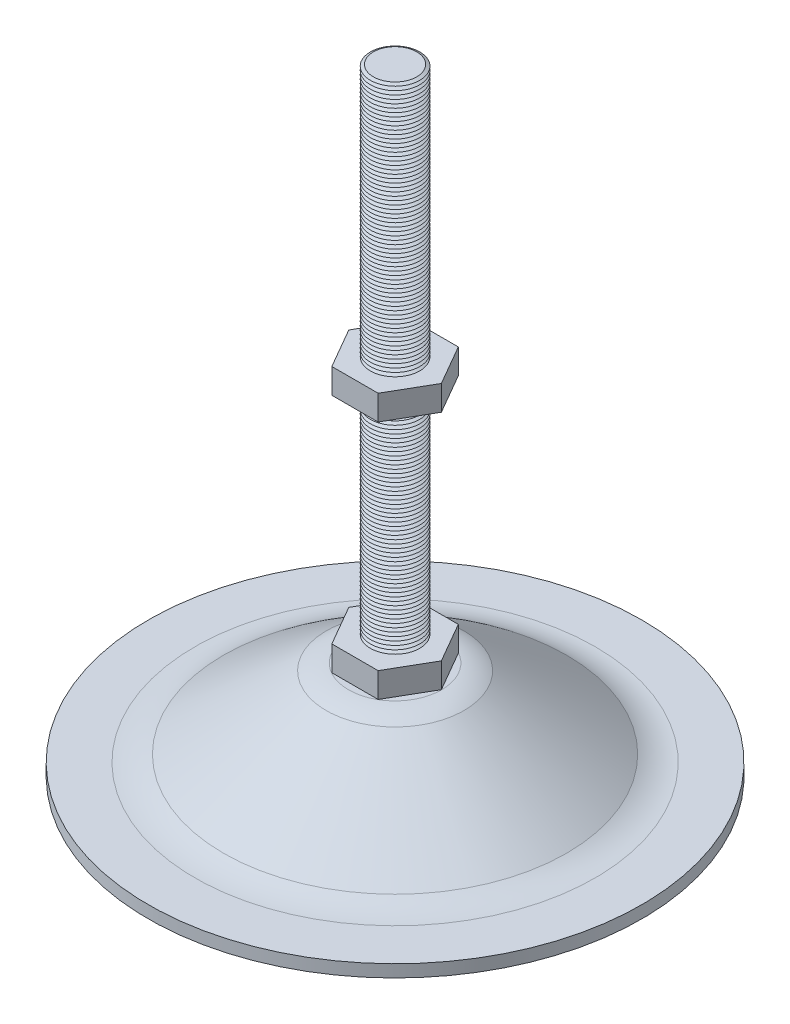
from build123d import *

# Parameters (mm, degrees)
SKETCH_3_W          = 34.813298254
SKETCH_3_H          = 36.284540707
CUT_EXTRUDE_1_DEPTH = 43


with BuildPart() as part:
    # 草图1 → 旋转1 (revolve)
    with BuildSketch(Plane.XY, mode=Mode.PRIVATE) as revolve_1_sk:
        with BuildLine():
            Line((40, -12), (40, -14))
            Line((40, -14), (32.460490166, -14))
            ThreePointArc((32.460490166, -14), (29.593413351, -13.652461995), (26.89240623, -12.629978423))
            Line((26.89240623, -12.629978423), (10.251565792, -0.913347718))
            ThreePointArc((10.251565792, -0.913347718), (8.450894377, -0.231692003), (6.539509834, 0))
            Line((6.539509834, 0), (0, 0))
            Line((0, 0), (0, 86))
            Line((0, 86), (3.512767881, 86))
            Line((3.512767881, 86), (4, 85.748990506))
            Line((4, 85.748990506), (3.4, 85.439885892))
            Line((3.4, 85.439885892), (4, 85.130781278))
            Line((4, 85.130781278), (3.4, 84.821676663))
            Line((3.4, 84.821676663), (4, 84.512572049))
            Line((4, 84.512572049), (3.4, 84.203467434))
            Line((3.4, 84.203467434), (4, 83.89436282))
            Line((4, 83.89436282), (3.4, 83.585258206))
            Line((3.4, 83.585258206), (4, 83.276153591))
            Line((4, 83.276153591), (3.4, 82.967048977))
            Line((3.4, 82.967048977), (4, 82.657944363))
            Line((4, 82.657944363), (3.4, 82.348839748))
            Line((3.4, 82.348839748), (4, 82.039735134))
            Line((4, 82.039735134), (3.4, 81.73063052))
            Line((3.4, 81.73063052), (4, 81.421525905))
            Line((4, 81.421525905), (3.4, 81.112421291))
            Line((3.4, 81.112421291), (4, 80.803316676))
            Line((4, 80.803316676), (3.4, 80.494212062))
            Line((3.4, 80.494212062), (4, 80.185107448))
            Line((4, 80.185107448), (3.4, 79.876002833))
            Line((3.4, 79.876002833), (4, 79.566898219))
            Line((4, 79.566898219), (3.4, 79.257793605))
            Line((3.4, 79.257793605), (4, 78.94868899))
            Line((4, 78.94868899), (3.4, 78.639584376))
            Line((3.4, 78.639584376), (4, 78.330479762))
            Line((4, 78.330479762), (3.4, 78.021375147))
            Line((3.4, 78.021375147), (4, 77.712270533))
            Line((4, 77.712270533), (3.4, 77.403165918))
            Line((3.4, 77.403165918), (4, 77.094061304))
            Line((4, 77.094061304), (3.4, 76.78495669))
            Line((3.4, 76.78495669), (4, 76.475852075))
            Line((4, 76.475852075), (3.4, 76.166747461))
            Line((3.4, 76.166747461), (4, 75.857642847))
            Line((4, 75.857642847), (3.4, 75.548538232))
            Line((3.4, 75.548538232), (4, 75.239433618))
            Line((4, 75.239433618), (3.4, 74.930329003))
            Line((3.4, 74.930329003), (4, 74.621224389))
            Line((4, 74.621224389), (3.4, 74.312119775))
            Line((3.4, 74.312119775), (4, 74.00301516))
            Line((4, 74.00301516), (3.4, 73.693910546))
            Line((3.4, 73.693910546), (4, 73.384805932))
            Line((4, 73.384805932), (3.4, 73.075701317))
            Line((3.4, 73.075701317), (4, 72.766596703))
            Line((4, 72.766596703), (3.4, 72.457492089))
            Line((3.4, 72.457492089), (4, 72.148387474))
            Line((4, 72.148387474), (3.4, 71.83928286))
            Line((3.4, 71.83928286), (4, 71.530178245))
            Line((4, 71.530178245), (3.4, 71.221073631))
            Line((3.4, 71.221073631), (4, 70.911969017))
            Line((4, 70.911969017), (3.4, 70.602864402))
            Line((3.4, 70.602864402), (4, 70.293759788))
            Line((4, 70.293759788), (3.4, 69.984655174))
            Line((3.4, 69.984655174), (4, 69.675550559))
            Line((4, 69.675550559), (3.4, 69.366445945))
            Line((3.4, 69.366445945), (4, 69.057341331))
            Line((4, 69.057341331), (3.4, 68.748236716))
            Line((3.4, 68.748236716), (4, 68.439132102))
            Line((4, 68.439132102), (3.4, 68.130027487))
            Line((3.4, 68.130027487), (4, 67.820922873))
            Line((4, 67.820922873), (3.4, 67.511818259))
            Line((3.4, 67.511818259), (4, 67.202713644))
            Line((4, 67.202713644), (3.4, 66.89360903))
            Line((3.4, 66.89360903), (4, 66.584504416))
            Line((4, 66.584504416), (3.4, 66.275399801))
            Line((3.4, 66.275399801), (4, 65.966295187))
            Line((4, 65.966295187), (3.4, 65.657190573))
            Line((3.4, 65.657190573), (4, 65.348085958))
            Line((4, 65.348085958), (3.4, 65.038981344))
            Line((3.4, 65.038981344), (4, 64.729876729))
            Line((4, 64.729876729), (3.4, 64.420772115))
            Line((3.4, 64.420772115), (4, 64.111667501))
            Line((4, 64.111667501), (3.4, 63.802562886))
            Line((3.4, 63.802562886), (4, 63.493458272))
            Line((4, 63.493458272), (3.4, 63.184353658))
            Line((3.4, 63.184353658), (4, 62.875249043))
            Line((4, 62.875249043), (3.4, 62.566144429))
            Line((3.4, 62.566144429), (4, 62.257039815))
            Line((4, 62.257039815), (3.4, 61.9479352))
            Line((3.4, 61.9479352), (4, 61.638830586))
            Line((4, 61.638830586), (3.4, 61.329725971))
            Line((3.4, 61.329725971), (4, 61.020621357))
            Line((4, 61.020621357), (3.4, 60.711516743))
            Line((3.4, 60.711516743), (4, 60.402412128))
            Line((4, 60.402412128), (3.4, 60.093307514))
            Line((3.4, 60.093307514), (4, 59.7842029))
            Line((4, 59.7842029), (3.4, 59.475098285))
            Line((3.4, 59.475098285), (4, 59.165993671))
            Line((4, 59.165993671), (3.4, 58.856889056))
            Line((3.4, 58.856889056), (4, 58.547784442))
            Line((4, 58.547784442), (3.4, 58.238679828))
            Line((3.4, 58.238679828), (4, 57.929575213))
            Line((4, 57.929575213), (3.4, 57.620470599))
            Line((3.4, 57.620470599), (4, 57.311365985))
            Line((4, 57.311365985), (3.4, 57.00226137))
            Line((3.4, 57.00226137), (4, 56.693156756))
            Line((4, 56.693156756), (3.4, 56.384052142))
            Line((3.4, 56.384052142), (4, 56.074947527))
            Line((4, 56.074947527), (3.4, 55.765842913))
            Line((3.4, 55.765842913), (4, 55.456738298))
            Line((4, 55.456738298), (3.4, 55.147633684))
            Line((3.4, 55.147633684), (4, 54.83852907))
            Line((4, 54.83852907), (3.4, 54.529424455))
            Line((3.4, 54.529424455), (4, 54.220319841))
            Line((4, 54.220319841), (3.4, 53.911215227))
            Line((3.4, 53.911215227), (4, 53.602110612))
            Line((4, 53.602110612), (3.4, 53.293005998))
            Line((3.4, 53.293005998), (4, 52.983901384))
            Line((4, 52.983901384), (3.4, 52.674796769))
            Line((3.4, 52.674796769), (4, 52.365692155))
            Line((4, 52.365692155), (3.4, 52.05658754))
            Line((3.4, 52.05658754), (4, 51.747482926))
            Line((4, 51.747482926), (3.4, 51.438378312))
            Line((3.4, 51.438378312), (4, 51.129273697))
            Line((4, 51.129273697), (3.4, 50.820169083))
            Line((3.4, 50.820169083), (4, 50.511064469))
            Line((4, 50.511064469), (3.4, 50.201959854))
            Line((3.4, 50.201959854), (4, 49.89285524))
            Line((4, 49.89285524), (3.4, 49.583750626))
            Line((3.4, 49.583750626), (4, 49.274646011))
            Line((4, 49.274646011), (3.4, 48.965541397))
            Line((3.4, 48.965541397), (4, 48.656436782))
            Line((4, 48.656436782), (3.4, 48.347332168))
            Line((3.4, 48.347332168), (4, 48.038227554))
            Line((4, 48.038227554), (3.4, 47.729122939))
            Line((3.4, 47.729122939), (4, 47.420018325))
            Line((4, 47.420018325), (3.4, 47.110913711))
            Line((3.4, 47.110913711), (4, 46.801809096))
            Line((4, 46.801809096), (3.4, 46.492704482))
            Line((3.4, 46.492704482), (4, 46.183599868))
            Line((4, 46.183599868), (3.4, 45.874495253))
            Line((3.4, 45.874495253), (4, 45.565390639))
            Line((4, 45.565390639), (3.4, 45.256286024))
            Line((3.4, 45.256286024), (3.995594301, 44.949451113))
            Line((3.995594301, 44.949451113), (7.5, 44.949451113))
            Line((7.5, 44.949451113), (7.5, 40.903217166))
            Line((7.5, 40.903217166), (3.449700178, 40.903217166))
            Line((3.449700178, 40.903217166), (4, 40.619716809))
            Line((4, 40.619716809), (3.4, 40.310612195))
            Line((3.4, 40.310612195), (4, 40.00150758))
            Line((4, 40.00150758), (3.4, 39.692402966))
            Line((3.4, 39.692402966), (4, 39.383298351))
            Line((4, 39.383298351), (3.4, 39.074193737))
            Line((3.4, 39.074193737), (4, 38.765089123))
            Line((4, 38.765089123), (3.4, 38.455984508))
            Line((3.4, 38.455984508), (4, 38.146879894))
            Line((4, 38.146879894), (3.4, 37.83777528))
            Line((3.4, 37.83777528), (4, 37.528670665))
            Line((4, 37.528670665), (3.4, 37.219566051))
            Line((3.4, 37.219566051), (4, 36.910461437))
            Line((4, 36.910461437), (3.4, 36.601356822))
            Line((3.4, 36.601356822), (4, 36.292252208))
            Line((4, 36.292252208), (3.4, 35.983147593))
            Line((3.4, 35.983147593), (4, 35.674042979))
            Line((4, 35.674042979), (3.4, 35.364938365))
            Line((3.4, 35.364938365), (4, 35.05583375))
            Line((4, 35.05583375), (3.4, 34.746729136))
            Line((3.4, 34.746729136), (4, 34.437624522))
            Line((4, 34.437624522), (3.4, 34.128519907))
            Line((3.4, 34.128519907), (4, 33.819415293))
            Line((4, 33.819415293), (3.4, 33.510310679))
            Line((3.4, 33.510310679), (4, 33.201206064))
            Line((4, 33.201206064), (3.4, 32.89210145))
            Line((3.4, 32.89210145), (4, 32.582996835))
            Line((4, 32.582996835), (3.4, 32.273892221))
            Line((3.4, 32.273892221), (4, 31.964787607))
            Line((4, 31.964787607), (3.4, 31.655682992))
            Line((3.4, 31.655682992), (4, 31.346578378))
            Line((4, 31.346578378), (3.4, 31.037473764))
            Line((3.4, 31.037473764), (4, 30.728369149))
            Line((4, 30.728369149), (3.4, 30.419264535))
            Line((3.4, 30.419264535), (4, 30.110159921))
            Line((4, 30.110159921), (3.4, 29.801055306))
            Line((3.4, 29.801055306), (4, 29.491950692))
            Line((4, 29.491950692), (3.4, 29.182846077))
            Line((3.4, 29.182846077), (4, 28.873741463))
            Line((4, 28.873741463), (3.4, 28.564636849))
            Line((3.4, 28.564636849), (4, 28.255532234))
            Line((4, 28.255532234), (3.4, 27.94642762))
            Line((3.4, 27.94642762), (4, 27.637323006))
            Line((4, 27.637323006), (3.4, 27.328218391))
            Line((3.4, 27.328218391), (4, 27.019113777))
            Line((4, 27.019113777), (3.4, 26.710009162))
            Line((3.4, 26.710009162), (4, 26.400904548))
            Line((4, 26.400904548), (3.4, 26.091799934))
            Line((3.4, 26.091799934), (4, 25.782695319))
            Line((4, 25.782695319), (3.4, 25.473590705))
            Line((3.4, 25.473590705), (4, 25.164486091))
            Line((4, 25.164486091), (3.4, 24.855381476))
            Line((3.4, 24.855381476), (4, 24.546276862))
            Line((4, 24.546276862), (3.4, 24.237172248))
            Line((3.4, 24.237172248), (4, 23.928067633))
            Line((4, 23.928067633), (3.4, 23.618963019))
            Line((3.4, 23.618963019), (4, 23.309858404))
            Line((4, 23.309858404), (3.4, 23.00075379))
            Line((3.4, 23.00075379), (4, 22.691649176))
            Line((4, 22.691649176), (3.4, 22.382544561))
            Line((3.4, 22.382544561), (4, 22.073439947))
            Line((4, 22.073439947), (3.4, 21.764335333))
            Line((3.4, 21.764335333), (4, 21.455230718))
            Line((4, 21.455230718), (3.4, 21.146126104))
            Line((3.4, 21.146126104), (4, 20.83702149))
            Line((4, 20.83702149), (3.4, 20.527916875))
            Line((3.4, 20.527916875), (4, 20.218812261))
            Line((4, 20.218812261), (3.4, 19.909707646))
            Line((3.4, 19.909707646), (4, 19.600603032))
            Line((4, 19.600603032), (3.4, 19.291498418))
            Line((3.4, 19.291498418), (4, 18.982393803))
            Line((4, 18.982393803), (3.4, 18.673289189))
            Line((3.4, 18.673289189), (4, 18.364184575))
            Line((4, 18.364184575), (3.4, 18.05507996))
            Line((3.4, 18.05507996), (4, 17.745975346))
            Line((4, 17.745975346), (3.4, 17.436870732))
            Line((3.4, 17.436870732), (4, 17.127766117))
            Line((4, 17.127766117), (3.4, 16.818661503))
            Line((3.4, 16.818661503), (4, 16.509556888))
            Line((4, 16.509556888), (3.4, 16.200452274))
            Line((3.4, 16.200452274), (4, 15.89134766))
            Line((4, 15.89134766), (3.4, 15.582243045))
            Line((3.4, 15.582243045), (4, 15.273138431))
            Line((4, 15.273138431), (3.4, 14.964033817))
            Line((3.4, 14.964033817), (4, 14.654929202))
            Line((4, 14.654929202), (3.4, 14.345824588))
            Line((3.4, 14.345824588), (4, 14.036719974))
            Line((4, 14.036719974), (3.4, 13.727615359))
            Line((3.4, 13.727615359), (4, 13.418510745))
            Line((4, 13.418510745), (3.4, 13.10940613))
            Line((3.4, 13.10940613), (4, 12.800301516))
            Line((4, 12.800301516), (3.4, 12.491196902))
            Line((3.4, 12.491196902), (4, 12.182092287))
            Line((4, 12.182092287), (3.4, 11.872987673))
            Line((3.4, 11.872987673), (4, 11.563883059))
            Line((4, 11.563883059), (3.4, 11.254778444))
            Line((3.4, 11.254778444), (4, 10.94567383))
            Line((4, 10.94567383), (3.4, 10.636569215))
            Line((3.4, 10.636569215), (4, 10.327464601))
            Line((4, 10.327464601), (3.4, 10.018359987))
            Line((3.4, 10.018359987), (4, 9.709255372))
            Line((4, 9.709255372), (3.4, 9.400150758))
            Line((3.4, 9.400150758), (4, 9.091046144))
            Line((4, 9.091046144), (3.4, 8.781941529))
            Line((3.4, 8.781941529), (4, 8.472836915))
            Line((4, 8.472836915), (3.4, 8.163732301))
            Line((3.4, 8.163732301), (4, 7.854627686))
            Line((4, 7.854627686), (3.4, 7.545523072))
            Line((3.4, 7.545523072), (4, 7.236418457))
            Line((4, 7.236418457), (3.4, 6.927313843))
            Line((3.4, 6.927313843), (4, 6.618209229))
            Line((4, 6.618209229), (3.4, 6.309104614))
            Line((3.4, 6.309104614), (4, 6))
            Line((4, 6), (7.5, 6))
            Line((7.5, 6), (7.5, 1.953766053))
            ThreePointArc((7.5, 1.953766053), (9.392853741, 1.584280283), (11.179579781, 0.858315353))
            Line((11.179579781, 0.858315353), (27.820420219, -10.858315353))
            ThreePointArc((27.820420219, -10.858315353), (30.071259487, -11.710384996), (32.460490166, -12))
            Line((32.460490166, -12), (40, -12))
        make_face()
    revolve(revolve_1_sk.sketch.rotate(Axis((0, 0, 0), (0, 1, 0)), 90), axis=Axis((0, 0, 0), (0, 1, 0)))

    # 草图3 → 切除-拉伸1 (cut)
    with BuildSketch(Plane(origin=(0, 44.949451113, 0), x_dir=(1, 0, 0), z_dir=(0, 1, 0))):
        with Locations((0.161669813, -3.429237493)):
            Rectangle(SKETCH_3_W, SKETCH_3_H)
        Polygon((7.505553499, 0), (3.75277675, 6.5), (-3.75277675, 6.5), (-7.505553499, 0), (-3.75277675, -6.5), (3.75277675, -6.5), align=None, mode=Mode.SUBTRACT)
    extrude(amount=-CUT_EXTRUDE_1_DEPTH, mode=Mode.SUBTRACT)


solid = part.part
